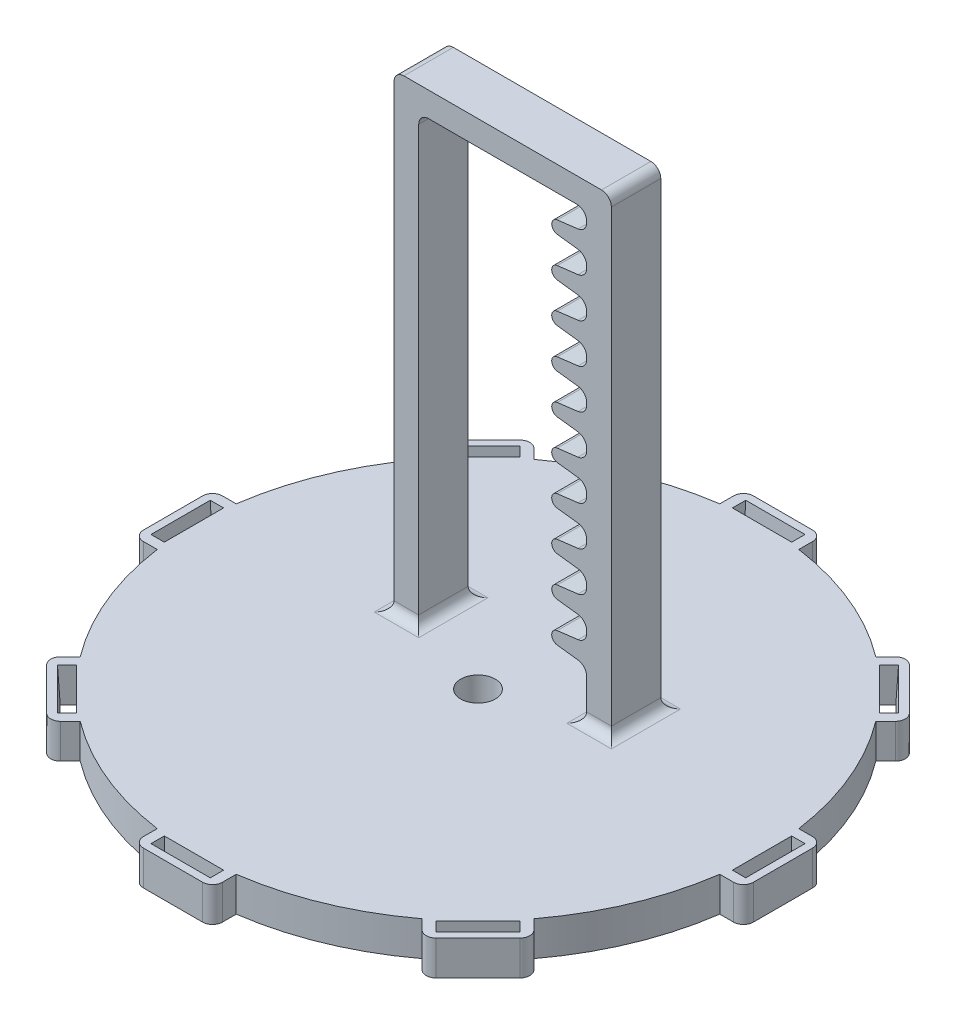
from build123d import *

# Parameters (mm, degrees)
BOSS_EXTRUDE1_DEPTH    = 7
SKETCH2_W              = 5
SKETCH2_H              = 10
BOSS_EXTRUDE2_DEPTH    = 95
SKETCH15_R             = 3.5
CUT_EXTRUDE3_DEPTH     = 7
CIRPATTERN1_COUNT      = 8
SKETCH18_W             = 10
SKETCH18_H             = 5
BOSS_EXTRUDE3_DEPTH    = 34
BOSS_EXTRUDE4_DEPTH    = 10
FILLET1_R              = 2
FILLET2_R              = 2
LPATTERN2_COUNT        = 10
LPATTERN2_PITCH        = 8
FILLET1_OF_LPATTERN2_R = 2


with BuildPart() as part:
    # Sketch1 → Boss-Extrude1 (new body)
    with BuildSketch(Plane(origin=(0, 0, 0), x_dir=(1, 0, 0), z_dir=(0, 1, 0))):
        with BuildLine():
            Line((-8, 56.940758688), (-8, 59.740758688))
            ThreePointArc((-8, 59.740758688), (-7.414213562, 61.154972251), (-6, 61.740758688))
            Line((-6, 61.740758688), (6, 61.740758688))
            ThreePointArc((6, 61.740758688), (7.414213562, 61.154972251), (8, 59.740758688))
            Line((8, 59.740758688), (8, 56.940758688))
            ThreePointArc((8, 56.940758688), (22.004297361, 53.123073119), (34.606342345, 45.920050844))
            Line((34.606342345, 45.920050844), (36.586241332, 47.899949831))
            ThreePointArc((36.586241332, 47.899949831), (38.000454895, 48.485736269), (39.414668457, 47.899949831))
            Line((39.414668457, 47.899949831), (47.899949831, 39.414668457))
            ThreePointArc((47.899949831, 39.414668457), (48.485736269, 38.000454895), (47.899949831, 36.586241332))
            Line((47.899949831, 36.586241332), (45.920050844, 34.606342345))
            ThreePointArc((45.920050844, 34.606342345), (53.123073119, 22.004297361), (56.940758688, 8))
            Line((56.940758688, 8), (59.740758688, 8))
            ThreePointArc((59.740758688, 8), (61.154972251, 7.414213562), (61.740758688, 6))
            Line((61.740758688, 6), (61.740758688, -6))
            ThreePointArc((61.740758688, -6), (61.154972251, -7.414213562), (59.740758688, -8))
            Line((59.740758688, -8), (56.940758688, -8))
            ThreePointArc((56.940758688, -8), (53.123073119, -22.004297361), (45.920050844, -34.606342345))
            Line((45.920050844, -34.606342345), (47.899949831, -36.586241332))
            ThreePointArc((47.899949831, -36.586241332), (48.485736269, -38.000454895), (47.899949831, -39.414668457))
            Line((47.899949831, -39.414668457), (39.414668457, -47.899949831))
            ThreePointArc((39.414668457, -47.899949831), (38.000454895, -48.485736269), (36.586241332, -47.899949831))
            Line((36.586241332, -47.899949831), (34.606342345, -45.920050844))
            ThreePointArc((34.606342345, -45.920050844), (22.004297361, -53.123073119), (8, -56.940758688))
            Line((8, -56.940758688), (8, -59.740758688))
            ThreePointArc((8, -59.740758688), (7.414213562, -61.154972251), (6, -61.740758688))
            Line((6, -61.740758688), (-6, -61.740758688))
            ThreePointArc((-6, -61.740758688), (-7.414213562, -61.154972251), (-8, -59.740758688))
            Line((-8, -59.740758688), (-8, -56.940758688))
            ThreePointArc((-8, -56.940758688), (-22.004297361, -53.123073119), (-34.606342345, -45.920050844))
            Line((-34.606342345, -45.920050844), (-36.586241332, -47.899949831))
            ThreePointArc((-36.586241332, -47.899949831), (-38.000454895, -48.485736269), (-39.414668457, -47.899949831))
            Line((-39.414668457, -47.899949831), (-47.899949831, -39.414668457))
            ThreePointArc((-47.899949831, -39.414668457), (-48.485736269, -38.000454895), (-47.899949831, -36.586241332))
            Line((-47.899949831, -36.586241332), (-45.920050844, -34.606342345))
            ThreePointArc((-45.920050844, -34.606342345), (-53.123073119, -22.004297361), (-56.940758688, -8))
            Line((-56.940758688, -8), (-59.740758688, -8))
            ThreePointArc((-59.740758688, -8), (-61.154972251, -7.414213562), (-61.740758688, -6))
            Line((-61.740758688, -6), (-61.740758688, 6))
            ThreePointArc((-61.740758688, 6), (-61.154972251, 7.414213562), (-59.740758688, 8))
            Line((-59.740758688, 8), (-56.940758688, 8))
            ThreePointArc((-56.940758688, 8), (-53.123073119, 22.004297361), (-45.920050844, 34.606342345))
            Line((-45.920050844, 34.606342345), (-47.899949831, 36.586241332))
            ThreePointArc((-47.899949831, 36.586241332), (-48.485736269, 38.000454895), (-47.899949831, 39.414668457))
            Line((-47.899949831, 39.414668457), (-39.414668457, 47.899949831))
            ThreePointArc((-39.414668457, 47.899949831), (-38.000454895, 48.485736269), (-36.586241332, 47.899949831))
            Line((-36.586241332, 47.899949831), (-34.606342345, 45.920050844))
            ThreePointArc((-34.606342345, 45.920050844), (-22.004297361, 53.123073119), (-8, 56.940758688))
        make_face()
    extrude(amount=BOSS_EXTRUDE1_DEPTH)

    # Sketch2 → Boss-Extrude2 (add)
    with BuildSketch(Plane(origin=(0, 7, 0), x_dir=(1, 0, 0), z_dir=(0, 1, 0))):
        with Locations((19.5, 10)):
            Rectangle(SKETCH2_W, SKETCH2_H)
        with Locations((-19.5, 10)):
            Rectangle(SKETCH2_W, SKETCH2_H)
    extrude(amount=BOSS_EXTRUDE2_DEPTH)

    # Sketch15 → Cut-Extrude3 (cut)
    with BuildSketch(Plane.XZ):
        with Locations(Location((0, 0, 0), (0, 0, 270))):
            Circle(SKETCH15_R)
    extrude(amount=-CUT_EXTRUDE3_DEPTH, mode=Mode.SUBTRACT)

    # Sketch16 → Cut-Loft2 section 0
    with BuildSketch(Plane.XZ):
        with BuildLine():
            Line((-6, 59.8), (6, 59.8))
            Line((6, 59.8), (6, 57.5))
            Line((6, 57.5), (-6, 57.5))
            Line((-6, 57.5), (-6, 59.8))
        make_face()
    # Sketch17 → Cut-Loft2 section 1
    with BuildSketch(Plane(origin=(0, 7, 0), x_dir=(1, 0, 0), z_dir=(0, 1, 0))):
        with BuildLine():
            Line((-6, -57.5), (6, -57.5))
            Line((6, -57.5), (6, -60.2))
            Line((6, -60.2), (-6, -60.2))
            Line((-6, -60.2), (-6, -57.5))
        make_face()
    cut_loft2 = loft(mode=Mode.SUBTRACT)

    # CirPattern1: Cut-Loft2 ×8 about axis
    cirpattern1_axis = Axis((0, 0, 0), (0, 1, 0))
    for i in range(1, CIRPATTERN1_COUNT):
        add(cut_loft2.rotate(cirpattern1_axis, i * 360 / CIRPATTERN1_COUNT), mode=Mode.SUBTRACT)

    # Sketch18 → Boss-Extrude3 (add)
    with BuildSketch(Plane(origin=(-17, 0, 0), x_dir=(0, 0, -1), z_dir=(1, 0, 0))):
        with Locations((10, 99.5)):
            Rectangle(SKETCH18_W, SKETCH18_H)
    extrude(amount=BOSS_EXTRUDE3_DEPTH)

    # Sketch19 → Boss-Extrude4 (add)
    with BuildSketch(Plane(origin=(0, 0, -15), x_dir=(-1, 0, 0), z_dir=(0, 0, -1))):
        with BuildLine():
            Line((-17, 93), (-11.04472309, 92.26878394))
            ThreePointArc((-11.04472309, 92.26878394), (-9.922197884, 91), (-11.04472309, 89.73121606))
            Line((-11.04472309, 89.73121606), (-17, 89))
            Line((-17, 89), (-17, 93))
        make_face()
    boss_extrude4 = extrude(amount=-BOSS_EXTRUDE4_DEPTH)

    # Fillet1
    fillet1_edges = [part.edges().sort_by_distance(p)[0] for p in [
        (17, 89, -10),
        (17, 93, -10),
    ]]
    fillet(fillet1_edges, radius=FILLET1_R)

    # Fillet2
    fillet2_edges = [part.edges().sort_by_distance(p)[0] for p in [
        (22, 7, -10),
        (19.5, 7, -15),
        (17, 7, -10),
        (19.5, 7, -5),
        (22, 102, -10),
        (-17, 7, -10),
        (-19.5, 7, -15),
        (-22, 7, -10),
        (-19.5, 7, -5),
        (-22, 102, -10),
        (-17, 97, -10),
        (17, 97, -10),
    ]]
    fillet(fillet2_edges, radius=FILLET2_R)

    # LPattern2: Boss-Extrude4 ×10
    with Locations(*[(0, -i * LPATTERN2_PITCH, 0) for i in range(1, LPATTERN2_COUNT)]):
        add(boss_extrude4)

    # Fillet1 of LPattern2
    fillet1_of_lpattern2_edges = [part.edges().sort_by_distance(p)[0] for p in [
        (17, 81, -10),
        (17, 85, -10),
        (17, 73, -10),
        (17, 77, -10),
        (17, 65, -10),
        (17, 69, -10),
        (17, 57, -10),
        (17, 61, -10),
        (17, 49, -10),
        (17, 53, -10),
        (17, 41, -10),
        (17, 45, -10),
        (17, 33, -10),
        (17, 37, -10),
        (17, 25, -10),
        (17, 29, -10),
        (17, 17, -10),
        (17, 21, -10),
    ]]
    fillet(fillet1_of_lpattern2_edges, radius=FILLET1_OF_LPATTERN2_R)


solid = part.part
